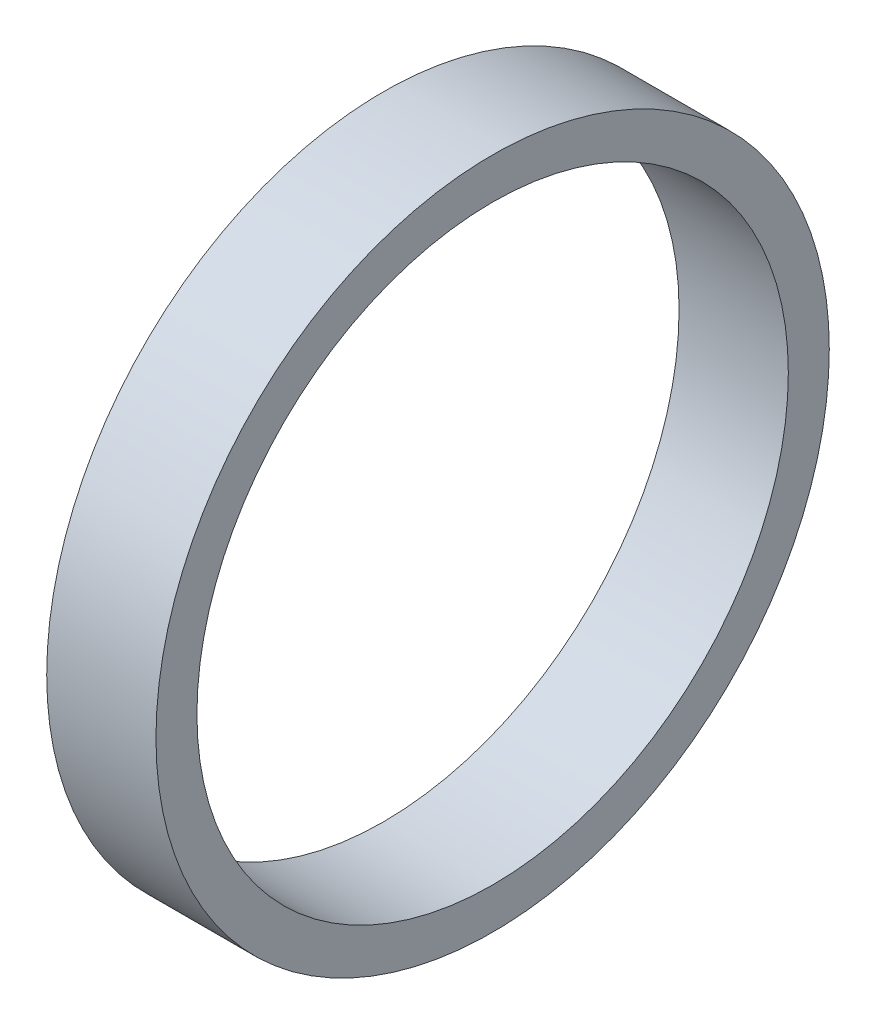
from build123d import *

# Parameters (mm, degrees)
SKETCH1_R           = 6.262000049
SKETCH1_R_2         = 5.500000049
BOSS_EXTRUDE1_DEPTH = 2.032


with BuildPart() as part:
    # Sketch1 → Boss-Extrude1 (new body)
    with BuildSketch(Plane.YZ):
        with Locations(Location((0, 0, 0), (0, 0, 270))):
            Circle(SKETCH1_R)
        with Locations(Location((0, 0, 0), (0, 0, 270))):
            Circle(SKETCH1_R_2, mode=Mode.SUBTRACT)
    extrude(amount=BOSS_EXTRUDE1_DEPTH)


solid = part.part
